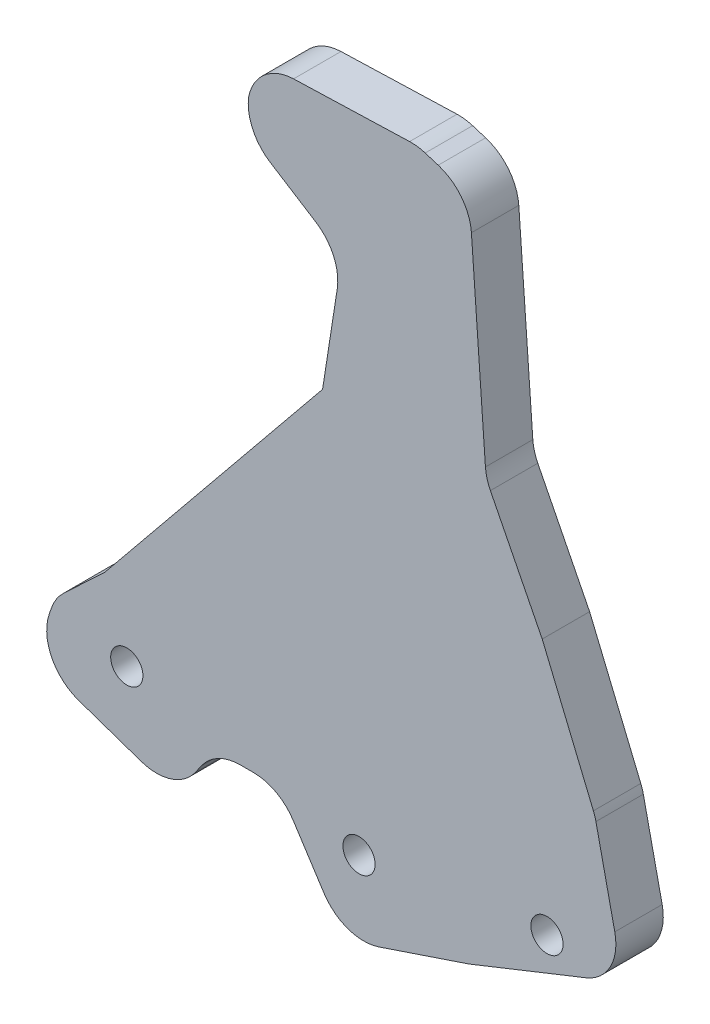
from build123d import *

# Parameters (mm, degrees)
SKETCH1_R           = 1.7
BOSS_EXTRUDE1_DEPTH = 5


with BuildPart() as part:
    # Sketch1 → Boss-Extrude1 (new body)
    with BuildSketch(Plane.XY):
        with BuildLine():
            ThreePointArc((-37.834642703, 12.842889611), (-38.606977712, 11.916261554), (-39.134911245, 10.831629309))
            Line((-39.134911245, 10.831629309), (-39.354944681, 10.193532345))
            ThreePointArc((-39.354944681, 10.193532345), (-39.123029117, 6.373731812), (-36.25803319, 3.83671402))
            Line((-36.25803319, 3.83671402), (-29.668188839, 1.564353899))
            ThreePointArc((-29.668188839, 1.564353899), (-26.491164954, 1.536581811), (-23.938801839, 3.428589895))
            Line((-23.938801839, 3.428589895), (-23.309086795, 4.330374611))
            ThreePointArc((-23.309086795, 4.330374611), (-21.521238753, 5.901319007), (-19.20965321, 6.467745699))
            Line((-19.20965321, 6.467745699), (-17.817780351, 6.467745699))
            ThreePointArc((-17.817780351, 6.467745699), (-15.427188658, 5.859222826), (-13.618488855, 4.181774242))
            Line((-13.618488855, 4.181774242), (-10.381594688, -0.826523177))
            ThreePointArc((-10.381594688, -0.826523177), (-7.83372555, -2.83190182), (-4.59138835, -2.852641252))
            Line((-4.59138835, -2.852641252), (4.902899214, 0.333885288))
            Line((4.902899214, 0.333885288), (17.263606315, 5.252218218))
            ThreePointArc((17.263606315, 5.252218218), (19.830876998, 7.552622541), (20.299269541, 10.967786846))
            Line((20.299269541, 10.967786846), (18.310232366, 20.048547406))
            ThreePointArc((18.310232366, 20.048547406), (18.19566052, 20.478915648), (18.043247633, 20.897381709))
            Line((18.043247633, 20.897381709), (12.643097146, 33.892720517))
            Line((12.643097146, 33.892720517), (7.177182545, 44.720280021))
            ThreePointArc((7.177182545, 44.720280021), (6.821120261, 45.642450212), (6.653441068, 46.616648291))
            Line((6.653441068, 46.616648291), (5.174876069, 67.279164767))
            ThreePointArc((5.174876069, 67.279164767), (4.105623253, 70.028623013), (1.672465938, 71.696726041))
            Line((1.672465938, 71.696726041), (0.300566202, 72.123383215))
            ThreePointArc((0.300566202, 72.123383215), (-0.512819916, 72.303655469), (-1.344848079, 72.346366128))
            Line((-1.344848079, 72.346366128), (-13.585713544, 71.953043516))
            ThreePointArc((-13.585713544, 71.953043516), (-16.669785637, 70.75986422), (-18.33462528, 67.902682661))
            ThreePointArc((-18.33462528, 67.902682661), (-17.88389808, 65.164771828), (-16.042829318, 63.088771694))
            Line((-16.042829318, 63.088771694), (-11.247293049, 60.054506954))
            ThreePointArc((-11.247293049, 60.054506954), (-9.367982736, 57.896266905), (-8.980115504, 55.060889264))
            Line((-8.980115504, 55.060889264), (-10.526035755, 45.120570864))
            Line((-10.526035755, 45.120570864), (-33.479905595, 16.940953472))
            Line((-33.479905595, 16.940953472), (-37.834642703, 12.842889611))
        make_face()
        with Locations((-31.17879703, 9.476441992)):
            Circle(SKETCH1_R, mode=Mode.SUBTRACT)
        with Locations((-6.681396598, 4.488719859)):
            Circle(SKETCH1_R, mode=Mode.SUBTRACT)
        with Locations((13.146755278, 7.104898975)):
            Circle(SKETCH1_R, mode=Mode.SUBTRACT)
    extrude(amount=BOSS_EXTRUDE1_DEPTH)


solid = part.part
